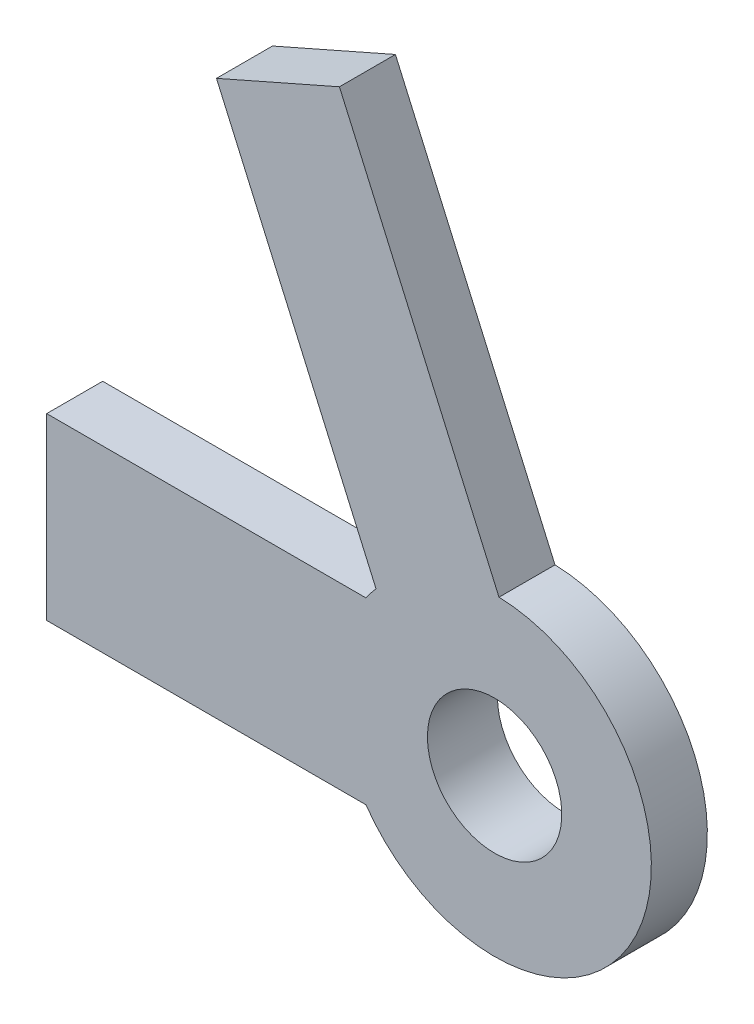
from build123d import *

# Parameters (mm, degrees)
BOSS_EXTRU_1_DEPTH      = 2.5
ESQUISSE2_R             = 10
BOSS_EXTRU_2_DEPTH      = 1.25
ESQUISSE3_R             = 6
ENL_V_MAT_EXTRU_1_DEPTH = 62.539171077


with BuildPart() as part:
    # Esquisse1 → Boss.-Extru.1 (new, symmetric)
    with BuildSketch(Plane.XY):
        with BuildLine():
            Line((0.392596459, 13.994494204), (-10.5894536, 9.157700172))
            ThreePointArc((-10.5894536, 9.157700172), (-11.054455161, 8.590635663), (-11.489125293, 8))
            Line((-11.489125293, 8), (-11.489125293, -8))
            ThreePointArc((-11.489125293, -8), (4.192388692, -13.357540082), (14, 0))
            ThreePointArc((14, 0), (10.03733905, 9.759704134), (0.392596459, 13.994494204))
        make_face()
        with BuildLine():
            ThreePointArc((0.392596459, 13.994494204), (-5.64292637, 12.812391735), (-10.5894536, 9.157700172))
            Line((-10.5894536, 9.157700172), (0.392596459, 13.994494204))
        make_face()
        with BuildLine():
            Line((-11.489125293, -8), (-11.489125293, 8))
            ThreePointArc((-11.489125293, 8), (-14, 0), (-11.489125293, -8))
        make_face()
        with BuildLine():
            ThreePointArc((-11.489125293, -8), (-14, 0), (-11.489125293, 8))
            Line((-11.489125293, 8), (-40, 8))
            Line((-40, 8), (-40, -8))
            Line((-40, -8), (-11.489125293, -8))
        make_face()
        with BuildLine():
            Line((-13.856151097, 46.346597251), (-24.838201156, 41.50980322))
            Line((-24.838201156, 41.50980322), (-10.5894536, 9.157700172))
            ThreePointArc((-10.5894536, 9.157700172), (-5.64292637, 12.812391735), (0.392596459, 13.994494204))
            Line((0.392596459, 13.994494204), (-13.856151097, 46.346597251))
        make_face()
    extrude(amount=BOSS_EXTRU_1_DEPTH, both=True)

    # Esquisse2 → Boss.-Extru.2 (add, symmetric)
    with BuildSketch(Plane(origin=(0, 0, -2.5), x_dir=(-1, 0, 0), z_dir=(0, 0, -1))):
        with Locations(Location((0, 0, 0), (0, 0, 180))):
            Circle(ESQUISSE2_R)
    extrude(amount=BOSS_EXTRU_2_DEPTH, both=True)

    # Esquisse3 → Enlèv. mat.-Extru.1 (cut, through all)
    with BuildSketch(Plane(origin=(0, 0, -3.75), x_dir=(-1, 0, 0), z_dir=(0, 0, -1))):
        Circle(ESQUISSE3_R)
    extrude(amount=-ENL_V_MAT_EXTRU_1_DEPTH, mode=Mode.SUBTRACT)


solid = part.part
